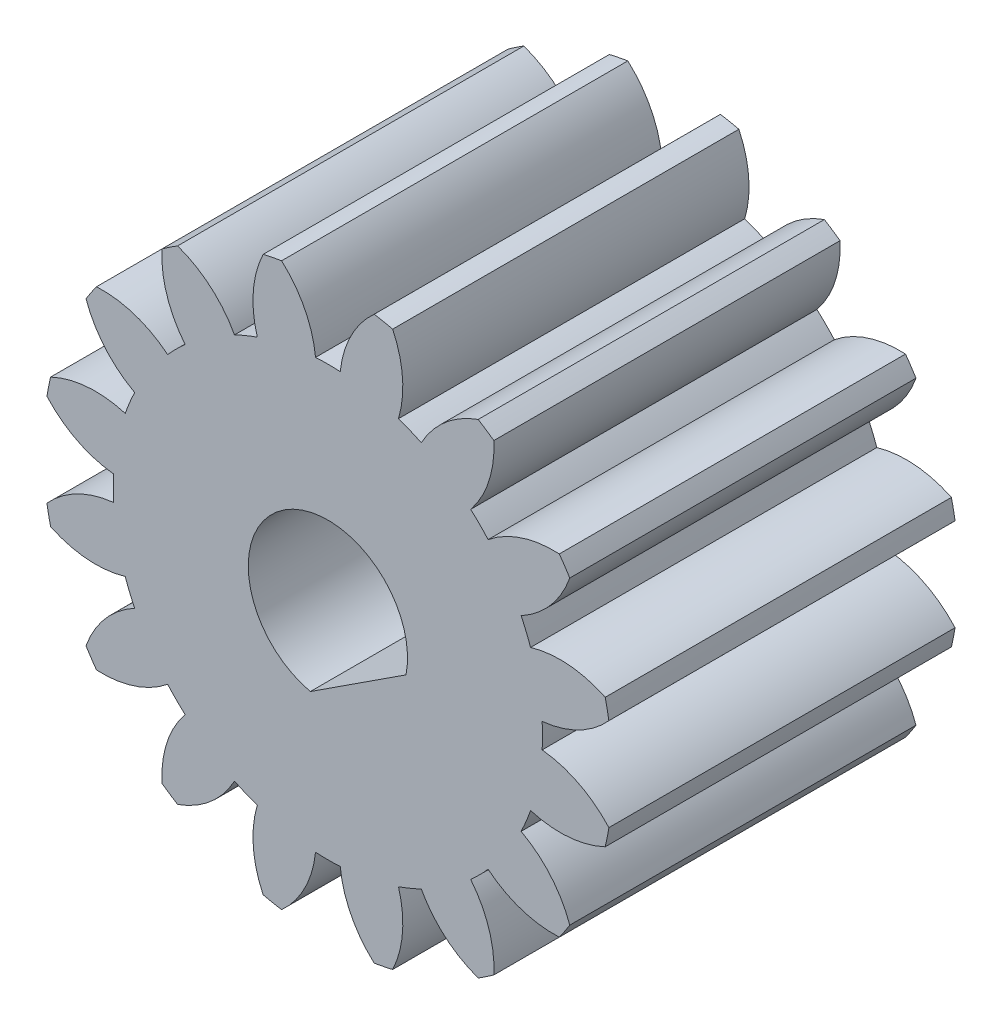
from build123d import *

# Parameters (mm, degrees)
BOSS_EXTRUDE1_DEPTH = 10


with BuildPart() as part:
    # Model → Boss-Extrude1 (new body)
    with BuildSketch(Plane.XY):
        with BuildLine():
            ThreePointArc((-8.115592249, 1.337081693), (-7.243390826, 0.66756543), (-6.188733379, 0.356623286))
            ThreePointArc((-6.188733379, 0.356623286), (-6.199, 0), (-6.188733379, -0.356623286))
            ThreePointArc((-6.188733379, -0.356623286), (-7.243390826, -0.66756543), (-8.115592249, -1.337081693))
            ThreePointArc((-8.115592249, -1.337081693), (-8.066958931, -1.604617899), (-8.009508584, -1.870400288))
            ThreePointArc((-8.009508584, -1.870400288), (-6.94748676, -2.155175626), (-5.854117924, -2.038848777))
            ThreePointArc((-5.854117924, -2.038848777), (-5.727129222, -2.372254597), (-5.581170278, -2.697802686))
            ThreePointArc((-5.581170278, -2.697802686), (-6.4365543, -3.388675701), (-6.986150561, -4.341005107))
            ThreePointArc((-6.986150561, -4.341005107), (-6.838837561, -4.569565167), (-6.684049844, -4.793130781))
            ThreePointArc((-6.684049844, -4.793130781), (-5.593890814, -4.649810729), (-4.628266083, -4.123924595))
            ThreePointArc((-4.628266083, -4.123924595), (-4.383354937, -4.383354937), (-4.123924596, -4.628266083))
            ThreePointArc((-4.123924596, -4.628266083), (-4.649810729, -5.593890814), (-4.793130781, -6.684049844))
            ThreePointArc((-4.793130781, -6.684049844), (-4.569565167, -6.838837561), (-4.341005107, -6.986150561))
            ThreePointArc((-4.341005107, -6.986150561), (-3.388675701, -6.4365543), (-2.697802686, -5.581170278))
            ThreePointArc((-2.697802686, -5.581170278), (-2.372254597, -5.727129222), (-2.038848777, -5.854117924))
            ThreePointArc((-2.038848777, -5.854117924), (-2.155175626, -6.94748676), (-1.870400288, -8.009508584))
            ThreePointArc((-1.870400288, -8.009508584), (-1.604617899, -8.066958931), (-1.337081693, -8.115592249))
            ThreePointArc((-1.337081693, -8.115592249), (-0.66756543, -7.243390826), (-0.356623286, -6.188733379))
            ThreePointArc((-0.356623286, -6.188733379), (0, -6.199), (0.356623286, -6.188733379))
            ThreePointArc((0.356623286, -6.188733379), (0.66756543, -7.243390826), (1.337081693, -8.115592249))
            ThreePointArc((1.337081693, -8.115592249), (1.604617899, -8.066958931), (1.870400288, -8.009508584))
            ThreePointArc((1.870400288, -8.009508584), (2.155175626, -6.94748676), (2.038848777, -5.854117924))
            ThreePointArc((2.038848777, -5.854117924), (2.372254597, -5.727129222), (2.697802686, -5.581170278))
            ThreePointArc((2.697802686, -5.581170278), (3.388675701, -6.4365543), (4.341005107, -6.986150561))
            ThreePointArc((4.341005107, -6.986150561), (4.569565167, -6.838837561), (4.793130781, -6.684049844))
            ThreePointArc((4.793130781, -6.684049844), (4.649810729, -5.593890814), (4.123924595, -4.628266083))
            ThreePointArc((4.123924595, -4.628266083), (4.383354937, -4.383354937), (4.628266083, -4.123924595))
            ThreePointArc((4.628266083, -4.123924595), (5.593890814, -4.649810729), (6.684049844, -4.79313078))
            ThreePointArc((6.684049844, -4.79313078), (6.838837561, -4.569565167), (6.986150561, -4.341005107))
            ThreePointArc((6.986150561, -4.341005107), (6.4365543, -3.388675701), (5.581170278, -2.697802686))
            ThreePointArc((5.581170278, -2.697802686), (5.727129222, -2.372254597), (5.854117924, -2.038848777))
            ThreePointArc((5.854117924, -2.038848777), (6.94748676, -2.155175626), (8.009508584, -1.870400288))
            ThreePointArc((8.009508584, -1.870400288), (8.066958931, -1.604617899), (8.115592249, -1.337081693))
            ThreePointArc((8.115592249, -1.337081693), (7.243390826, -0.66756543), (6.188733379, -0.356623286))
            ThreePointArc((6.188733379, -0.356623286), (6.199, 0), (6.188733379, 0.356623286))
            ThreePointArc((6.188733379, 0.356623286), (7.243390826, 0.66756543), (8.115592249, 1.337081693))
            ThreePointArc((8.115592249, 1.337081693), (8.066958931, 1.604617899), (8.009508584, 1.870400288))
            ThreePointArc((8.009508584, 1.870400288), (6.94748676, 2.155175626), (5.854117924, 2.038848777))
            ThreePointArc((5.854117924, 2.038848777), (5.727129222, 2.372254597), (5.581170278, 2.697802686))
            ThreePointArc((5.581170278, 2.697802686), (6.4365543, 3.388675701), (6.986150561, 4.341005107))
            ThreePointArc((6.986150561, 4.341005107), (6.838837561, 4.569565167), (6.684049844, 4.793130781))
            ThreePointArc((6.684049844, 4.793130781), (5.593890814, 4.649810729), (4.628266083, 4.123924595))
            ThreePointArc((4.628266083, 4.123924595), (4.383354937, 4.383354937), (4.123924595, 4.628266083))
            ThreePointArc((4.123924595, 4.628266083), (4.649810729, 5.593890814), (4.79313078, 6.684049844))
            ThreePointArc((4.79313078, 6.684049844), (4.569565167, 6.838837561), (4.341005107, 6.986150561))
            ThreePointArc((4.341005107, 6.986150561), (3.388675701, 6.4365543), (2.697802686, 5.581170278))
            ThreePointArc((2.697802686, 5.581170278), (2.372254597, 5.727129222), (2.038848777, 5.854117924))
            ThreePointArc((2.038848777, 5.854117924), (2.155175626, 6.94748676), (1.870400288, 8.009508584))
            ThreePointArc((1.870400288, 8.009508584), (1.604617899, 8.066958931), (1.337081693, 8.115592249))
            ThreePointArc((1.337081693, 8.115592249), (0.66756543, 7.243390826), (0.356623286, 6.188733379))
            ThreePointArc((0.356623286, 6.188733379), (0, 6.199), (-0.356623286, 6.188733379))
            ThreePointArc((-0.356623286, 6.188733379), (-0.66756543, 7.243390826), (-1.337081693, 8.115592249))
            ThreePointArc((-1.337081693, 8.115592249), (-1.604617899, 8.066958931), (-1.870400288, 8.009508584))
            ThreePointArc((-1.870400288, 8.009508584), (-2.155175626, 6.94748676), (-2.038848777, 5.854117924))
            ThreePointArc((-2.038848777, 5.854117924), (-2.372254597, 5.727129222), (-2.697802686, 5.581170278))
            ThreePointArc((-2.697802686, 5.581170278), (-3.388675701, 6.4365543), (-4.341005107, 6.986150561))
            ThreePointArc((-4.341005107, 6.986150561), (-4.569565167, 6.838837561), (-4.793130781, 6.684049844))
            ThreePointArc((-4.793130781, 6.684049844), (-4.649810729, 5.593890814), (-4.123924595, 4.628266083))
            ThreePointArc((-4.123924595, 4.628266083), (-4.383354937, 4.383354937), (-4.628266083, 4.123924595))
            ThreePointArc((-4.628266083, 4.123924595), (-5.593890814, 4.649810729), (-6.684049844, 4.79313078))
            ThreePointArc((-6.684049844, 4.79313078), (-6.838837561, 4.569565167), (-6.986150561, 4.341005107))
            ThreePointArc((-6.986150561, 4.341005107), (-6.4365543, 3.388675701), (-5.581170278, 2.697802686))
            ThreePointArc((-5.581170278, 2.697802686), (-5.727129222, 2.372254597), (-5.854117924, 2.038848777))
            ThreePointArc((-5.854117924, 2.038848777), (-6.94748676, 2.155175626), (-8.009508584, 1.870400288))
            ThreePointArc((-8.009508584, 1.870400288), (-8.066958931, 1.604617899), (-8.115592249, 1.337081693))
        make_face()
        with BuildLine():
            Line((-0.506237517, -2.243596126), (2.256391081, -0.445756983))
            ThreePointArc((2.256391081, -0.445756983), (-1.254518143, 1.927740706), (-0.506237517, -2.243596126))
        make_face(mode=Mode.SUBTRACT)
    extrude(amount=BOSS_EXTRUDE1_DEPTH)


solid = part.part
